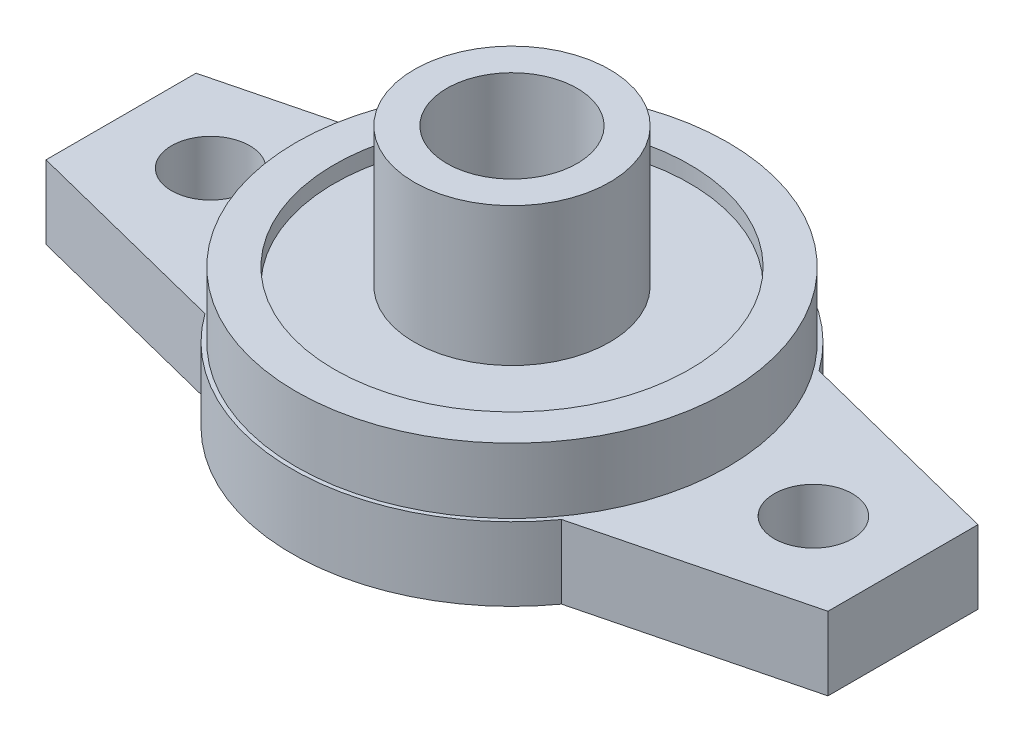
from build123d import *

# Parameters (mm, degrees)
SKETCH_1_R          = 2.4
SKETCH_1_R_2        = 13.5
SKETCH_1_R_3        = 4
EXTRUDE_1_DEPTH     = 4.5
SKETCH_2_R          = 13.25
SKETCH_2_R_2        = 4
EXTRUDE_2_DEPTH     = 4
SKETCH_3_R          = 6
SKETCH_3_R_2        = 4
EXTRUDE_3_DEPTH     = 7.5
CUT_EXTRUDE_START   = -1
SKETCH_4_R          = 10.9
SKETCH_4_R_2        = 6
CUT_EXTRUDE_1_DEPTH = 1


with BuildPart() as part:
    # 草图1 → 凸台-拉伸1 (new body)
    # profile 1 of 3: a face of its own
    with BuildSketch(Plane(origin=(0, 0, 0), x_dir=(1, 0, 0), z_dir=(0, 1, 0))):
        with BuildLine():
            Line((-10.945124025, 7.902800774), (-24, 4.60495562))
            Line((-24, 4.60495562), (-24, -4.60495562))
            Line((-24, -4.60495562), (-10.945124025, -7.902800774))
            ThreePointArc((-10.945124025, -7.902800774), (-13.5, 0), (-10.945124025, 7.902800774))
        make_face()
        with Locations(Location((-18.5, 0, 0), (0, 0, 270))):
            Circle(SKETCH_1_R, mode=Mode.SUBTRACT)
    # profile 2 of 3: a face of its own
    with BuildSketch(Plane(origin=(0, 0, 0), x_dir=(1, 0, 0), z_dir=(0, 1, 0))):
        Circle(SKETCH_1_R_2)
        with Locations(Location((0, 0, 0), (0, 0, 270))):
            Circle(SKETCH_1_R_3, mode=Mode.SUBTRACT)
    # profile 3 of 3: a face of its own
    with BuildSketch(Plane(origin=(0, 0, 0), x_dir=(1, 0, 0), z_dir=(0, 1, 0))):
        with BuildLine():
            Line((24, 4.60495562), (10.945124025, 7.902800774))
            ThreePointArc((10.945124025, 7.902800774), (12.845411133, 4.152759665), (13.5, 0))
            ThreePointArc((13.5, 0), (12.845411133, -4.152759665), (10.945124025, -7.902800774))
            Line((10.945124025, -7.902800774), (24, -4.60495562))
            Line((24, -4.60495562), (24, 4.60495562))
        make_face()
        with Locations(Location((18.5, 0, 0), (0, 0, 270))):
            Circle(SKETCH_1_R, mode=Mode.SUBTRACT)
    extrude(amount=EXTRUDE_1_DEPTH)

    # 草图2 → 凸台-拉伸2 (add)
    with BuildSketch(Plane(origin=(0, 4.5, 0), x_dir=(1, 0, 0), z_dir=(0, 1, 0))):
        with Locations(Location((0, 0, 0), (0, 0, 270))):
            Circle(SKETCH_2_R)
        with Locations(Location((0, 0, 0), (0, 0, 270))):
            Circle(SKETCH_2_R_2, mode=Mode.SUBTRACT)
    extrude(amount=EXTRUDE_2_DEPTH)

    # 草图3 → 凸台-拉伸3 (add)
    with BuildSketch(Plane(origin=(0, 8.5, 0), x_dir=(1, 0, 0), z_dir=(0, 1, 0))):
        with Locations(Location((0, 0, 0), (0, 0, 270))):
            Circle(SKETCH_3_R)
        with Locations(Location((0, 0, 0), (0, 0, 270))):
            Circle(SKETCH_3_R_2, mode=Mode.SUBTRACT)
    extrude(amount=EXTRUDE_3_DEPTH)

    # 草图4 → 切除-拉伸1 (cut)
    with BuildSketch(Plane(origin=(0, 8.5, 0), x_dir=(1, 0, 0), z_dir=(0, 1, 0)).offset(CUT_EXTRUDE_START)):
        with Locations(Location((0, 0, 0), (0, 0, 270))):
            Circle(SKETCH_4_R)
        with Locations(Location((0, 0, 0), (0, 0, 270))):
            Circle(SKETCH_4_R_2, mode=Mode.SUBTRACT)
    extrude(amount=CUT_EXTRUDE_1_DEPTH, mode=Mode.SUBTRACT)


solid = part.part
